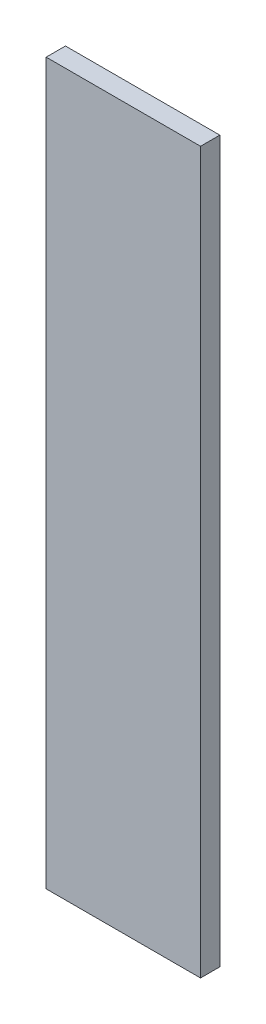
from build123d import *

# Parameters (mm, degrees)
SKETCH_1_W         = 24
SKETCH_1_H         = 112
BLOCKEXTRUDE_DEPTH = 3


with BuildPart() as part:
    # 草图1 → BlockExtrude (new body)
    with BuildSketch(Plane.XY):
        with Locations((12, 56)):
            Rectangle(SKETCH_1_W, SKETCH_1_H)
    extrude(amount=BLOCKEXTRUDE_DEPTH)


solid = part.part
